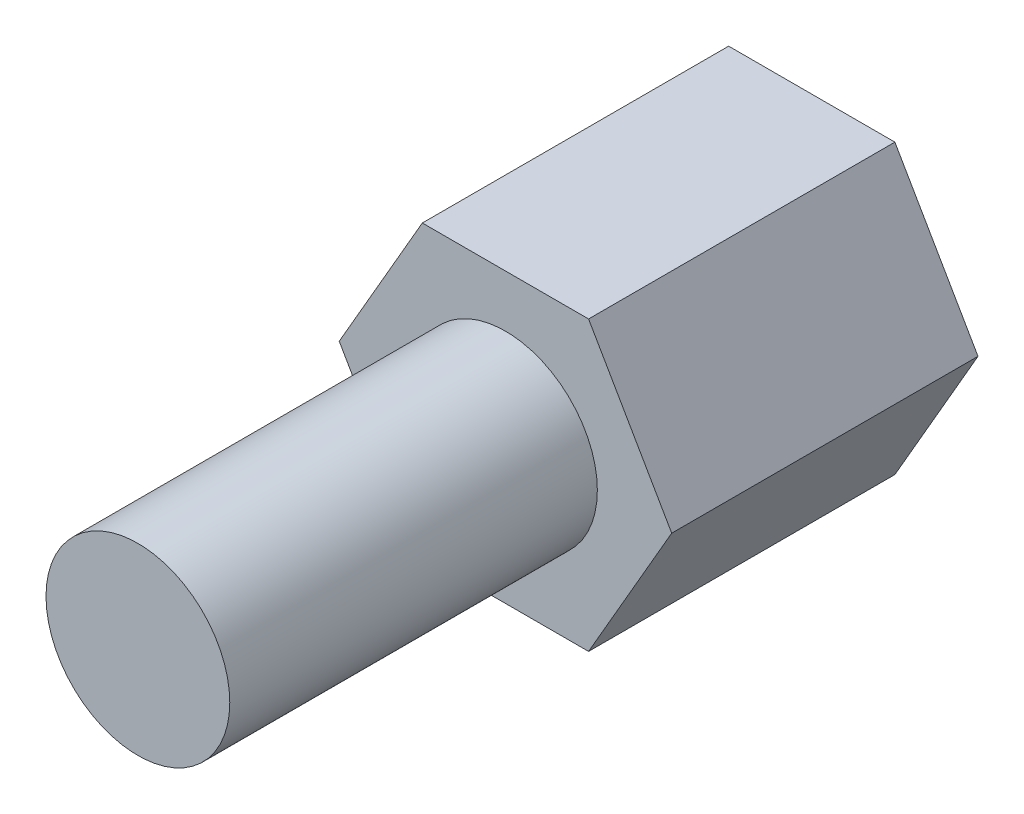
from build123d import *

# Parameters (mm, degrees)
EXTRUDE_1_DEPTH     = 5
SKETCH_2_R          = 1.5
EXTRUDE_2_DEPTH     = 6
SKETCH_3_R          = 1.5
CUT_EXTRUDE_1_DEPTH = 5


with BuildPart() as part:
    # 草图1 → 凸台-拉伸1 (new body)
    with BuildSketch(Plane.XY):
        Polygon((2.713546265, 0), (1.356773133, 2.35), (-1.356773133, 2.35), (-2.713546265, 0), (-1.356773133, -2.35), (1.356773133, -2.35), align=None)
    extrude(amount=EXTRUDE_1_DEPTH)

    # 草图2 → 凸台-拉伸2 (add)
    with BuildSketch(Plane.XY.offset(5)):
        Circle(SKETCH_2_R)
    extrude(amount=EXTRUDE_2_DEPTH)

    # 草图3 → 切除-拉伸1 (cut)
    with BuildSketch(Plane(origin=(0, 0, 0), x_dir=(-1, 0, 0), z_dir=(0, 0, -1))):
        Circle(SKETCH_3_R)
    extrude(amount=-CUT_EXTRUDE_1_DEPTH, mode=Mode.SUBTRACT)


with BuildPart() as cut_extrude_1_piece_1:
    # of the separate pieces the step leaves, piece 1, a body of its own (cut_extrude_1_pieces)
    add(part.part.solids().sort_by_distance((2.713546265, 0, 0))[0])


with BuildPart() as cut_extrude_1_piece_2:
    # of the separate pieces the step leaves, piece 2, a body of its own (cut_extrude_1_pieces)
    add(part.part.solids().sort_by_distance((1.5, 0, 11))[0])


solid = Compound([cut_extrude_1_piece_1.part, cut_extrude_1_piece_2.part])
